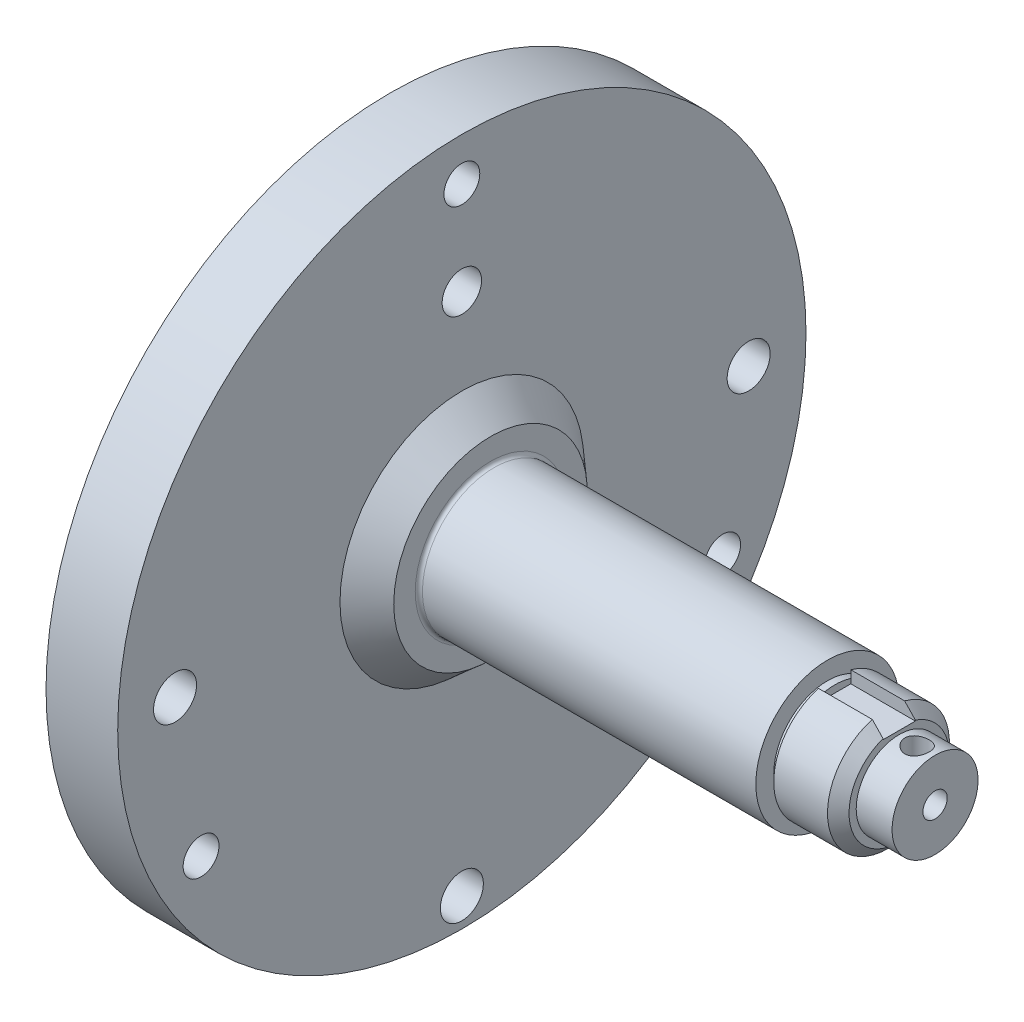
from build123d import *

# Parameters (mm, degrees)
ESQUISSE3_R             = 3
ENL_V_MAT_EXTRU_1_DEPTH = 102.901913623
ESQUISSE7_R             = 3
ENL_V_MAT_EXTRU_2_DEPTH = 102.901913623
TROU_TARAUD_M63_D       = 5
TROU_TARAUD_M63_DEPTH   = 15
TROU_TARAUD_M63_TIP     = 1.502151548
D_GAGEMENT_M37_REACH    = 105.064
D_GAGEMENT_M37_BORE_R   = 1.7
ESQUISSE6_W             = 10.447703872
ESQUISSE6_H             = 4.5
ENL_V_MAT_EXTRU_3_DEPTH = 2
D_GAGEMENT_M51_D        = 5.5
D_GAGEMENT_M51_DEPTH    = 12
D_GAGEMENT_M51_TIP      = 1.652366702


with BuildPart() as part:
    # Esquisse1 → Révolution2 (revolve)
    with BuildSketch(Plane.XY, mode=Mode.PRIVATE) as r_volution2_sk:
        with BuildLine():
            Line((0, 0), (74.5, 0))
            Line((74.5, 0), (74.5, -6))
            Line((74.5, -6), (69.5, -6))
            Line((69.5, -6), (69.5, -7))
            Line((69.5, -7), (68, -8.5))
            Line((68, -8.5), (60.5, -8.5))
            Line((60.5, -8.5), (60.5, -7.5))
            Line((60.5, -7.5), (59.5, -7.5))
            Line((59.5, -7.5), (59.5, -10))
            Line((59.5, -10), (13, -10))
            ThreePointArc((13, -10), (12.646446609, -10.146446609), (12.5, -10.5))
            Line((12.5, -10.5), (12.5, -13.5))
            Line((12.5, -13.5), (8.5, -17))
            Line((8.5, -17), (8.5, -48))
            Line((8.5, -48), (-1.5, -48))
            Line((-1.5, -48), (-1.5, -35))
            Line((-1.5, -35), (0, -35))
            Line((0, -35), (0, 0))
        make_face()
    revolve(r_volution2_sk.sketch.rotate(Axis((-50.843487897, 0, 0), (1, 0, 0)), 270), axis=Axis((-50.843487897, 0, 0), (1, 0, 0)))

    # Esquisse2 → Dégagement M32 (revolve, cut)
    with BuildSketch(Plane(origin=(74.5, 0, 0), x_dir=(0, 0, -1), z_dir=(0, 1, 0))):
        Polygon((0, 0), (0, 14.981495458), (1.7, 14), (1.7, 0), align=None)
    revolve(axis=Axis((80.85, 0, 0), (-1, 0, 0)), mode=Mode.SUBTRACT)

    # Esquisse3 → Enlèv. mat.-Extru.1 (cut, through all)
    with BuildSketch(Plane.ZY.offset(1.5)):
        with Locations((-40, 0)):
            Circle(ESQUISSE3_R)
        with Locations((40, 0)):
            Circle(ESQUISSE3_R)
    extrude(amount=-ENL_V_MAT_EXTRU_1_DEPTH, mode=Mode.SUBTRACT)

    # Esquisse7 → Enlèv. mat.-Extru.2 (cut, through all)
    with BuildSketch(Plane.ZY.offset(1.5)):
        with Locations((0, -44)):
            Circle(ESQUISSE7_R)
    extrude(amount=-ENL_V_MAT_EXTRU_2_DEPTH, mode=Mode.SUBTRACT)

    # Trou taraudé M63
    with Locations(Plane(origin=(-1.5, 42, 0), x_dir=(0, 0, -1), z_dir=(-1, 0, 0))):
        with Locations((0, 0), (36.373066959, 63), (-36.373066959, 63)):
            Hole(TROU_TARAUD_M63_D / 2, depth=TROU_TARAUD_M63_DEPTH)
            with Locations((0, 0, -(TROU_TARAUD_M63_DEPTH + TROU_TARAUD_M63_TIP / 2))):  # 118° drill point
                Cone(0, TROU_TARAUD_M63_D / 2, TROU_TARAUD_M63_TIP, mode=Mode.SUBTRACT)

    # Dégagement M37 bore (on position points) → Dégagement M37 (cut, up to next)
    with BuildSketch(Plane(origin=(72, 6, 0), x_dir=(0, 0, 1), z_dir=(0, 1, 0)), mode=Mode.PRIVATE) as d_gagement_m37_sk1:
        Circle(D_GAGEMENT_M37_BORE_R)
    d_gagement_m37_tool1 = extrude(d_gagement_m37_sk1.sketch, amount=-D_GAGEMENT_M37_REACH, mode=Mode.PRIVATE) & part.part
    add(d_gagement_m37_tool1.solids().sort_by_distance((72, 6, 0))[0], mode=Mode.SUBTRACT)

    # Esquisse6 → Enlèv. mat.-Extru.3 (cut)
    with BuildSketch(Plane(origin=(0, 8.5, 0), x_dir=(-1, 0, 0), z_dir=(0, 1, 0))):
        with Locations((-65.723851936, 0)):
            Rectangle(ESQUISSE6_W, ESQUISSE6_H)
    extrude(amount=-ENL_V_MAT_EXTRU_3_DEPTH, mode=Mode.SUBTRACT)

    # Dégagement M51
    with Locations(Plane(origin=(8.5, 29, 0), x_dir=(0, 0, 1), z_dir=(1, 0, 0))):
        with Locations((0, 0)):
            Hole(D_GAGEMENT_M51_D / 2, depth=D_GAGEMENT_M51_DEPTH)
            with Locations((0, 0, -(D_GAGEMENT_M51_DEPTH + D_GAGEMENT_M51_TIP / 2))):  # 118° drill point
                Cone(0, D_GAGEMENT_M51_D / 2, D_GAGEMENT_M51_TIP, mode=Mode.SUBTRACT)


solid = part.part
